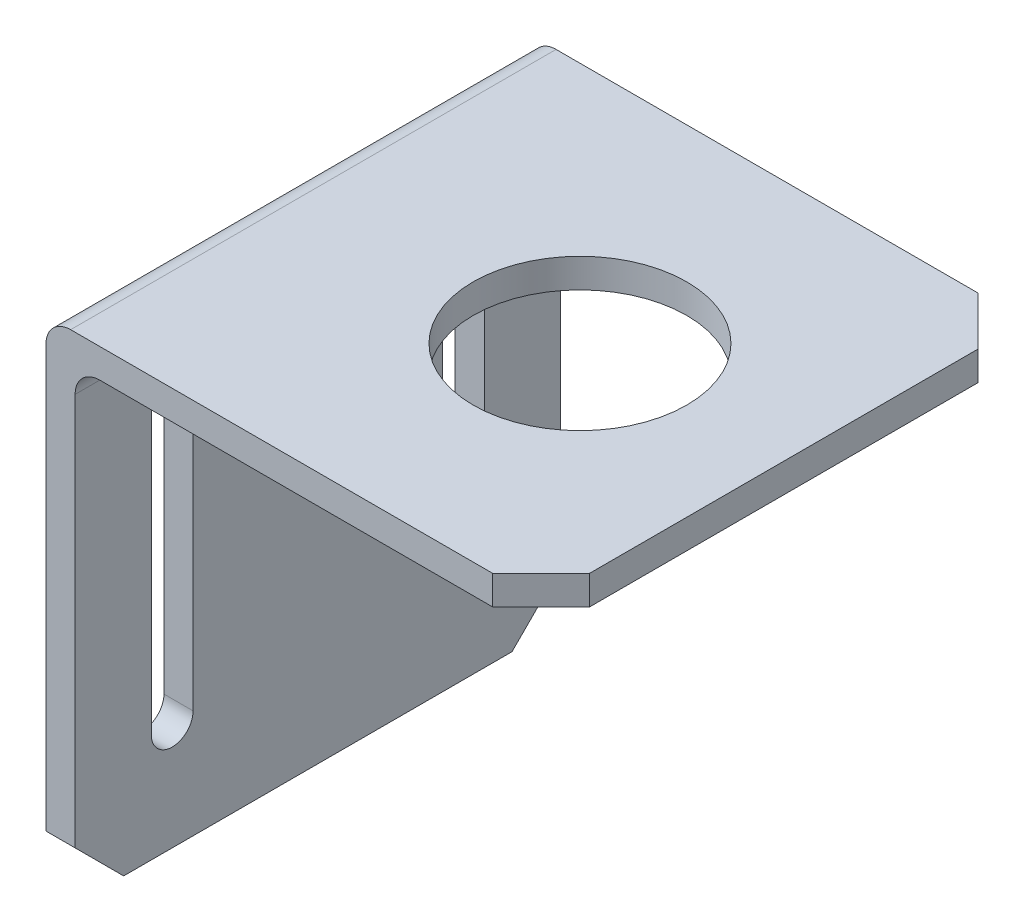
from build123d import *

# Parameters (mm, degrees)
BOSS_EXTRUDE1_DEPTH = 50
CHAMFER1_SIZE       = 5
FILLET1_R           = 2.54
CUT_EXTRUDE1_DEPTH  = 50
SKETCH4_R           = 11
CUT_EXTRUDE2_DEPTH  = 3


with BuildPart() as part:
    # Sketch1 → Boss-Extrude1 (new body)
    with BuildSketch(Plane.XY):
        Polygon((-58.93139542, -35.722112977), (-55.93139542, -35.722112977), (-55.93139542, 12.277887023), (-7.93139542, 12.277887023), (-7.93139542, 15.277887023), (-58.93139542, 15.277887023), align=None)
    extrude(amount=BOSS_EXTRUDE1_DEPTH)

    # Chamfer1
    chamfer1_edges = [part.edges().sort_by_distance(p)[0] for p in [
        (-7.93139542, 13.777887023, 50),
        (-7.93139542, 13.777887023, 0),
        (-57.43139542, -35.722112977, 50),
        (-57.43139542, -35.722112977, 0),
    ]]
    chamfer(chamfer1_edges, length=CHAMFER1_SIZE)

    # Fillet1
    fillet1_edges = [part.edges().sort_by_distance(p)[0] for p in [
        (-58.93139542, 15.277887023, 25),
        (-55.93139542, 12.277887023, 25),
    ]]
    fillet(fillet1_edges, radius=FILLET1_R)

    # Sketch3 → Cut-Extrude1 (cut)
    with BuildSketch(Plane(origin=(-55.93139542, 0, 0), x_dir=(0, 0, -1), z_dir=(1, 0, 0))):
        with BuildLine():
            Line((-37.85, 5.127887023), (-37.85, -24.572112977))
            ThreePointArc((-37.85, -24.572112977), (-40, -26.722112977), (-42.15, -24.572112977))
            Line((-42.15, -24.572112977), (-42.15, 5.127887023))
            ThreePointArc((-42.15, 5.127887023), (-40, 7.277887023), (-37.85, 5.127887023))
        make_face()
        with BuildLine():
            Line((-12.15, 5.127887023), (-12.15, -24.572112977))
            ThreePointArc((-12.15, -24.572112977), (-10, -26.722112977), (-7.85, -24.572112977))
            Line((-7.85, -24.572112977), (-7.85, 5.127887023))
            ThreePointArc((-7.85, 5.127887023), (-10, 7.277887023), (-12.15, 5.127887023))
        make_face()
    extrude(amount=-CUT_EXTRUDE1_DEPTH, mode=Mode.SUBTRACT)

    # Sketch4 → Cut-Extrude2 (cut)
    with BuildSketch(Plane(origin=(0, 15.277887023, 0), x_dir=(1, 0, 0), z_dir=(0, 1, 0))):
        with Locations(Location((-28.93139542, -25, 0), (0, 0, 180))):
            Circle(SKETCH4_R)
    extrude(amount=-CUT_EXTRUDE2_DEPTH, mode=Mode.SUBTRACT)


solid = part.part
